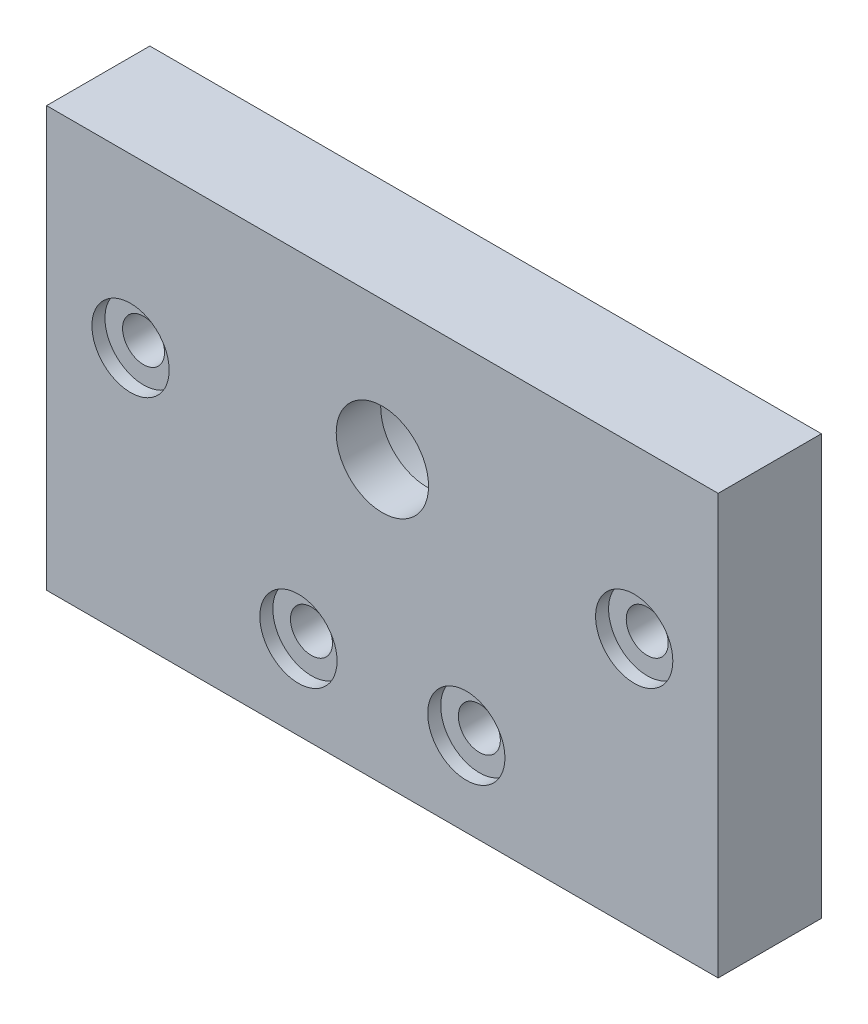
from build123d import *

# Parameters (mm, degrees)
SKETCH1_W           = 80
SKETCH1_H           = 50
SKETCH1_R           = 5.5
SKETCH1_R_2         = 2.5
BOSS_EXTRUDE1_DEPTH = 12.3
SKETCH2_R           = 4.6
CUT_EXTRUDE1_DEPTH  = 1.55
SKETCH3_R           = 11
CUT_EXTRUDE2_DEPTH  = 7


with BuildPart() as part:
    # Sketch1 → Boss-Extrude1 (new body)
    with BuildSketch(Plane.XY):
        with Locations((40, 25)):
            Rectangle(SKETCH1_W, SKETCH1_H)
        with Locations((40, 33.5)):
            Circle(SKETCH1_R, mode=Mode.SUBTRACT)
        with Locations((10, 30)):
            Circle(SKETCH1_R_2, mode=Mode.SUBTRACT)
        with Locations(Location((70, 30, 0), (0, 0, 180))):
            Circle(SKETCH1_R_2, mode=Mode.SUBTRACT)
        with Locations((30, 10)):
            Circle(SKETCH1_R_2, mode=Mode.SUBTRACT)
        with Locations(Location((50, 10, 0), (0, 0, 180))):
            Circle(SKETCH1_R_2, mode=Mode.SUBTRACT)
    extrude(amount=BOSS_EXTRUDE1_DEPTH)

    # Sketch2 → Cut-Extrude1 (cut)
    with BuildSketch(Plane.XY.offset(12.3)):
        with Locations((10, 30)):
            Circle(SKETCH2_R)
        with Locations((70, 30)):
            Circle(SKETCH2_R)
        with Locations((30, 10)):
            Circle(SKETCH2_R)
        with Locations((50, 10)):
            Circle(SKETCH2_R)
    extrude(amount=-CUT_EXTRUDE1_DEPTH, mode=Mode.SUBTRACT)

    # Sketch3 → Cut-Extrude2 (cut)
    with BuildSketch(Plane(origin=(0, 0, 0), x_dir=(-1, 0, 0), z_dir=(0, 0, -1))):
        with Locations((-40, 33.5)):
            Circle(SKETCH3_R)
    extrude(amount=-CUT_EXTRUDE2_DEPTH, mode=Mode.SUBTRACT)


solid = part.part
